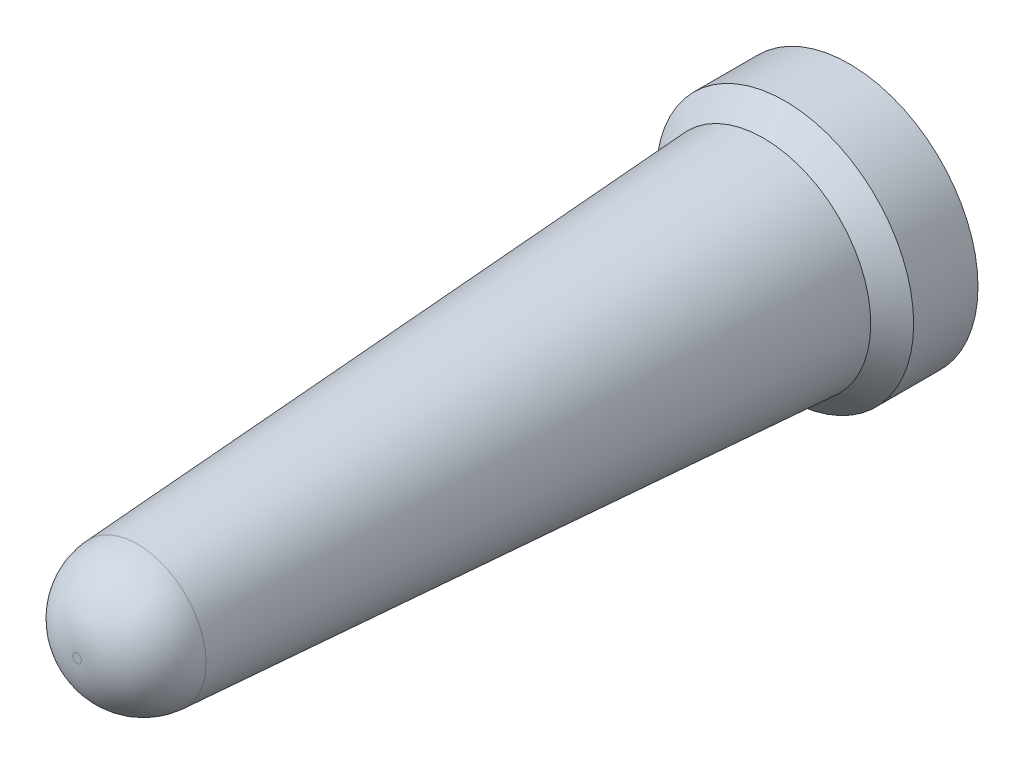
from build123d import *


with BuildPart() as part:
    # Sketch1 → Revolve1 (revolve)
    with BuildSketch(Plane(origin=(0, 0, 0), x_dir=(1, 0, 0), z_dir=(0, 1, 0))):
        with BuildLine():
            Line((0.2032, 0), (0.381, 0))
            Line((0.381, 0), (0.381, -0.1905))
            Line((0.381, -0.1905), (0.3175, -0.254))
            Line((0.3175, -0.254), (0.2032, -2.107227033))
            ThreePointArc((0.2032, -2.107227033), (0.143553155, -2.234288057), (0.013061296, -2.286))
            Line((0.013061296, -2.286), (0, -2.286))
            Line((0, -2.286), (0, -0.292828475))
            Line((0, -0.292828475), (0.2032, -0.1905))
            Line((0.2032, -0.1905), (0.2032, 0))
        make_face()
    revolve(axis=Axis((0, 0, 2.286), (0, 0, -1)))


solid = part.part
